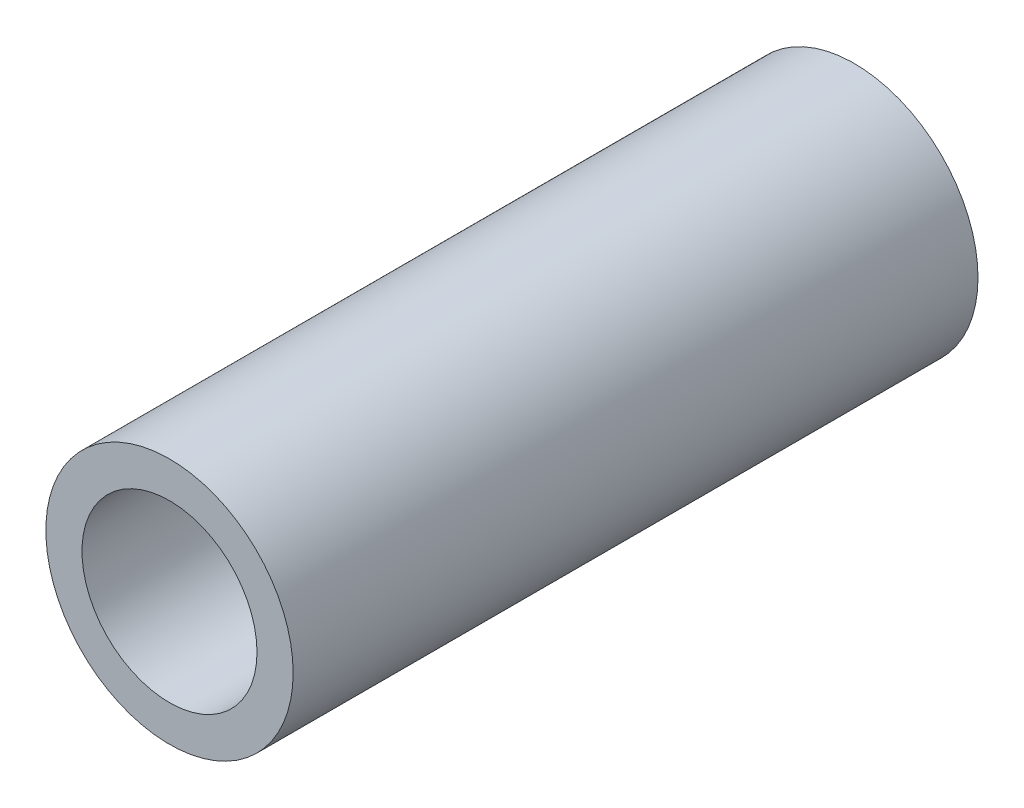
from build123d import *

# Parameters (mm, degrees)
SKETCH1_R           = 3.25
SKETCH1_R_2         = 2.3
BOSS_EXTRUDE1_DEPTH = 18


with BuildPart() as part:
    # Sketch1 → Boss-Extrude1 (new body)
    with BuildSketch(Plane.XY):
        Circle(SKETCH1_R)
        Circle(SKETCH1_R_2, mode=Mode.SUBTRACT)
    extrude(amount=BOSS_EXTRUDE1_DEPTH)


solid = part.part
